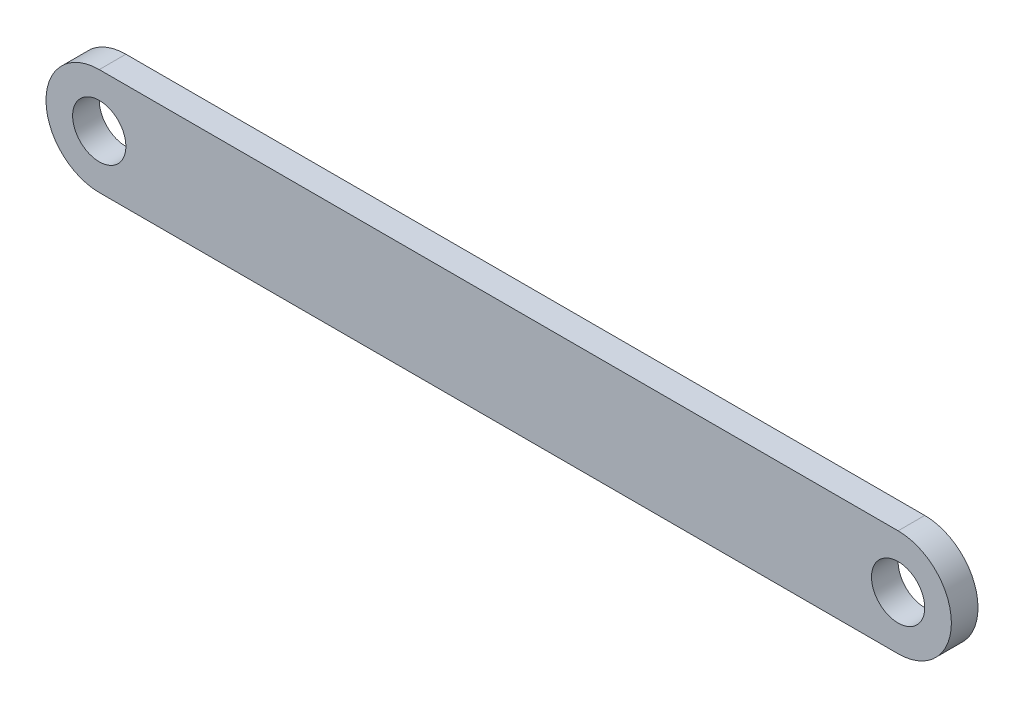
from build123d import *

# Parameters (mm, degrees)
SKETCH1_R           = 31.75
BOSS_EXTRUDE1_DEPTH = 15.875


with BuildPart() as part:
    # Sketch1 → Boss-Extrude1 (new, symmetric)
    with BuildSketch(Plane.XY):
        with BuildLine():
            Line((-476.25, 63.657439452), (476.25, 63.657439452))
            ThreePointArc((476.25, 63.657439452), (539.75, 0.157439452), (476.25, -63.342560548))
            Line((476.25, -63.342560548), (-476.25, -63.342560548))
            ThreePointArc((-476.25, -63.342560548), (-539.75, 0.157439452), (-476.25, 63.657439452))
        make_face()
        with Locations((-476.25, 0.157439452)):
            Circle(SKETCH1_R, mode=Mode.SUBTRACT)
        with Locations((476.25, 0.157439452)):
            Circle(SKETCH1_R, mode=Mode.SUBTRACT)
    extrude(amount=BOSS_EXTRUDE1_DEPTH, both=True)


solid = part.part
